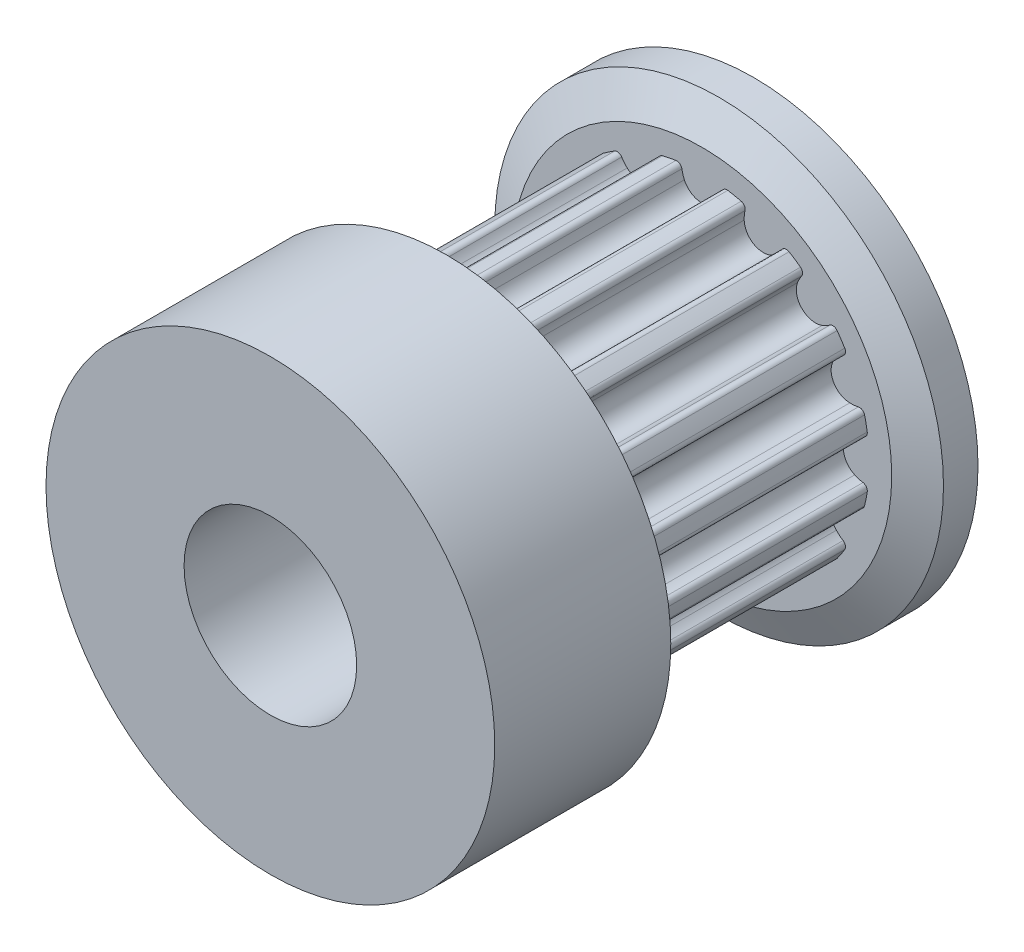
from build123d import *

# Parameters (mm, degrees)
SKETCH1_R            = 4.85
BASE_DEPTH           = 7.4
TOOTHCUT_DEPTH       = 11.089846381
TEETHCUTS_COUNT      = 16
SKETCH3_W            = 6.5
SKETCH3_H            = 5.1
SHAFTHOLE_DEPTH      = 16.516120649
SHAFTHOLE_DEPTH_BACK = 16.516120649
SKETCH4_R            = 2.5


with BuildPart() as part:
    # Sketch1 → Base (new body)
    with BuildSketch(Plane.XY):
        Circle(SKETCH1_R)
    extrude(amount=BASE_DEPTH)

    # Sketch2 → ToothCut (cut, through all)
    with BuildSketch(Plane.XY.offset(7.4)):
        with BuildLine():
            Line((-0.758707155, 4.790288452), (-0.789765541, 5.545021864))
            Line((-0.789765541, 5.545021864), (0.920739556, 5.545021864))
            Line((0.920739556, 5.545021864), (0.758707155, 4.790288452))
            ThreePointArc((0.758707155, 4.790288452), (0.754679502, 4.790924634), (0.750651316, 4.79155743))
            ThreePointArc((0.750651316, 4.79155743), (0.639888447, 4.765166202), (0.579571668, 4.668590862))
            ThreePointArc((0.579571668, 4.668590862), (0.550654119, 4.546148399), (0.506591342, 4.428305906))
            ThreePointArc((0.506591342, 4.428305906), (0, 4.1), (-0.506591342, 4.428305906))
            ThreePointArc((-0.506591342, 4.428305906), (-0.550654119, 4.546148399), (-0.579571668, 4.668590862))
            ThreePointArc((-0.579571668, 4.668590862), (-0.639888447, 4.765166202), (-0.750651316, 4.79155743))
            ThreePointArc((-0.750651316, 4.79155743), (-0.754679502, 4.790924634), (-0.758707155, 4.790288452))
        make_face()
    toothcut = extrude(amount=-TOOTHCUT_DEPTH, mode=Mode.SUBTRACT)

    # TeethCuts: ToothCut ×16 about axis
    teethcuts_axis = Axis((0, 0, 0), (0, 0, 1))
    for i in range(1, TEETHCUTS_COUNT):
        add(toothcut.rotate(teethcuts_axis, i * 360 / TEETHCUTS_COUNT), mode=Mode.SUBTRACT)

    # Sketch3 → Body (revolve)
    with BuildSketch(Plane(origin=(0, 0, 0), x_dir=(1, 0, 0), z_dir=(0, 1, 0)), mode=Mode.PRIVATE) as body_sk:
        Polygon((0, 0), (0, 1.5), (-6.5, 1.5), (-6.5, 0.5), (-5.5, 0), align=None)
        with Locations((-3.25, -9.95)):
            Rectangle(SKETCH3_W, SKETCH3_H)
    revolve(body_sk.sketch.rotate(Axis((0, 0, 12.5), (0, 0, -1)), 180), axis=Axis((0, 0, 12.5), (0, 0, -1)))

    # Sketch4 → ShaftHole (cut, two sides: drawn at the far end of the back side and taken through both)
    with BuildSketch(Plane.XY.offset(-SHAFTHOLE_DEPTH_BACK)):
        Circle(SKETCH4_R)
    extrude(amount=SHAFTHOLE_DEPTH + SHAFTHOLE_DEPTH_BACK, mode=Mode.SUBTRACT)


solid = part.part
